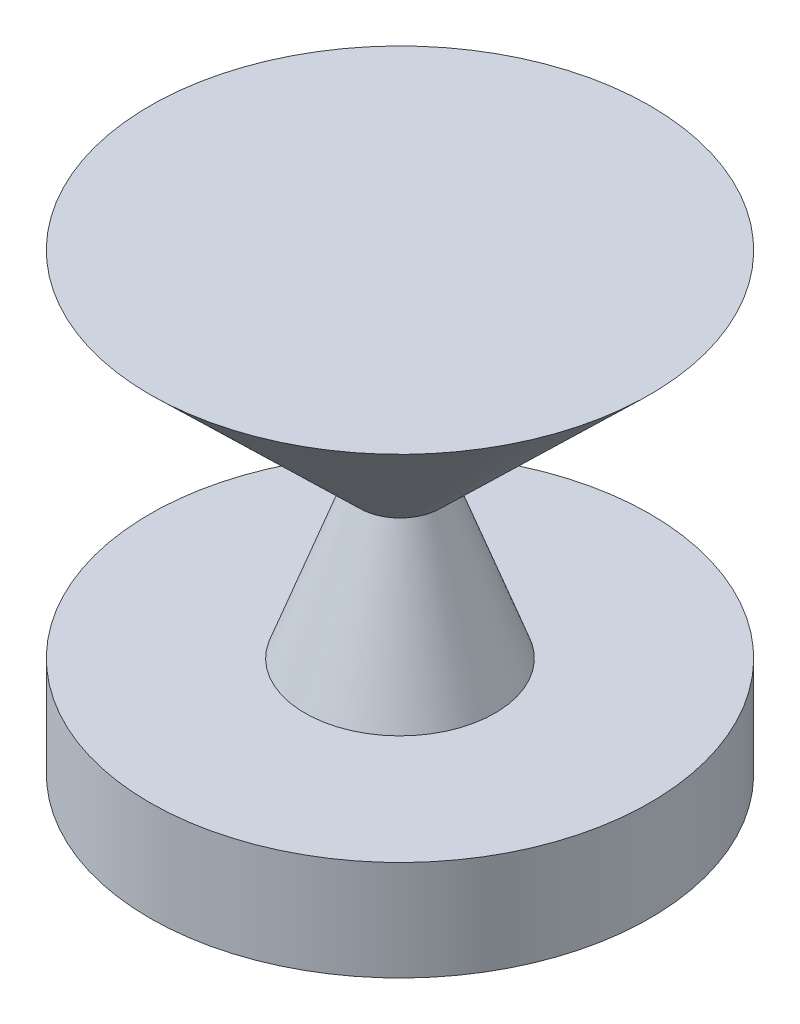
from build123d import *


with BuildPart() as part:
    # Sketch1 → Revolve1 (revolve)
    with BuildSketch(Plane.XY, mode=Mode.PRIVATE) as revolve1_sk:
        Polygon((0, 0), (-5, 0), (-5, 2), (-1.9, 2), (-0.808089297, 5), (-5, 9.066915357), (0, 9.066915357), (0, 5), align=None)
    revolve(revolve1_sk.sketch.rotate(Axis((0, 0, 0), (0, 1, 0)), 270), axis=Axis((0, 0, 0), (0, 1, 0)))


solid = part.part
